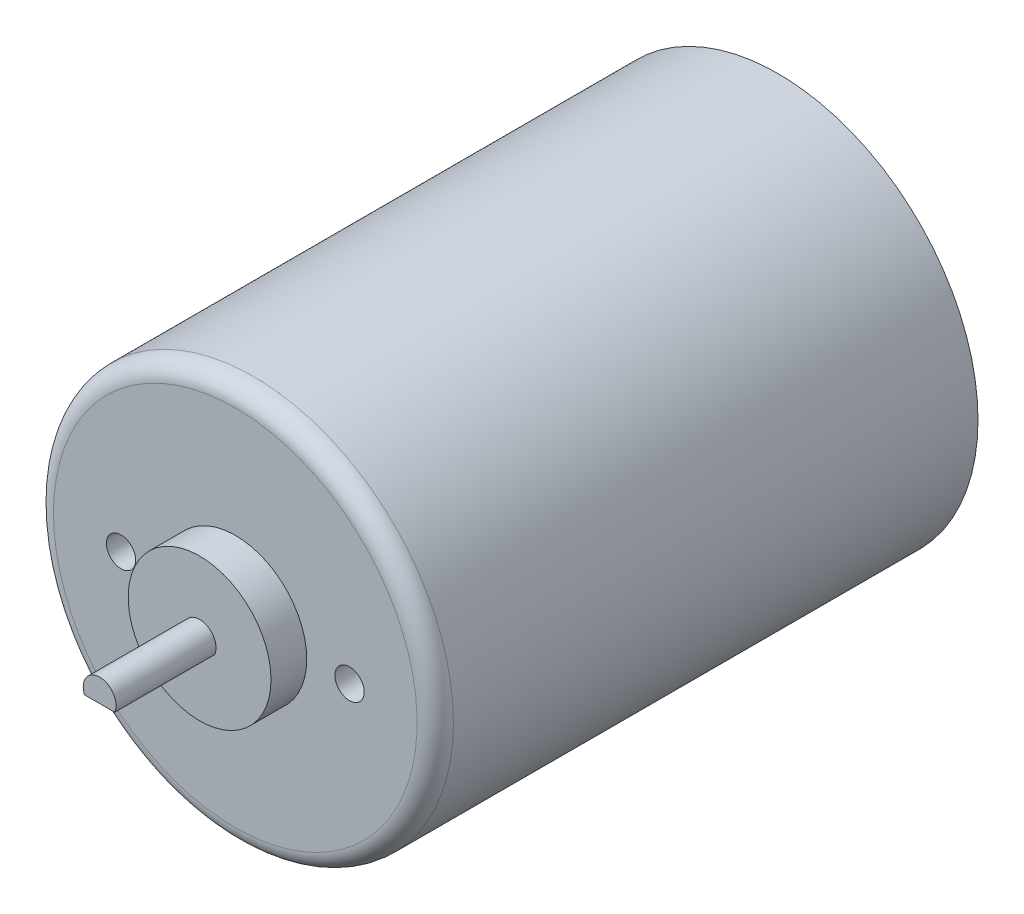
from build123d import *

# Parameters (mm, degrees)
BOSS_EXTRUDE1_DEPTH          = 7
M2_5X0_45_TAPPED_HOLE1_D     = 2.05
M2_5X0_45_TAPPED_HOLE1_DEPTH = 6.4262
M2_5X0_45_TAPPED_HOLE1_TIP   = 0.615882135
FILLET1_R                    = 1.27


with BuildPart() as part:
    # Sketch1 → Revolve1 (revolve)
    with BuildSketch(Plane(origin=(0, 0, 0), x_dir=(0, 0, -1), z_dir=(1, 0, 0)), mode=Mode.PRIVATE) as revolve1_sk:
        Polygon((-2.5, 0), (-2.5, 5), (0, 5), (0, 14), (38, 14), (38, 0), align=None)
    revolve(revolve1_sk.sketch.rotate(Axis((0, 0, 0), (0, 0, -1)), 90), axis=Axis((0, 0, 0), (0, 0, -1)))

    # Sketch2 → Boss-Extrude1 (add)
    with BuildSketch(Plane.XY.offset(2.5)):
        with BuildLine():
            Line((-1.058300524, -0.45), (1.058300524, -0.45))
            ThreePointArc((1.058300524, -0.45), (0, 1.15), (-1.058300524, -0.45))
        make_face()
    extrude(amount=BOSS_EXTRUDE1_DEPTH)

    # M2.5x0.45 Tapped Hole1
    with Locations(Plane.XY):
        with Locations((8, 0), (-8, 0)):
            Hole(M2_5X0_45_TAPPED_HOLE1_D / 2, depth=M2_5X0_45_TAPPED_HOLE1_DEPTH)
            with Locations((0, 0, -(M2_5X0_45_TAPPED_HOLE1_DEPTH + M2_5X0_45_TAPPED_HOLE1_TIP / 2))):  # 118° drill point
                Cone(0, M2_5X0_45_TAPPED_HOLE1_D / 2, M2_5X0_45_TAPPED_HOLE1_TIP, mode=Mode.SUBTRACT)

    # Fillet1
    fillet1_edges = [part.edges().sort_by_distance(p)[0] for p in [
        (-14, 0, 0),
    ]]
    fillet(fillet1_edges, radius=FILLET1_R)


solid = part.part
